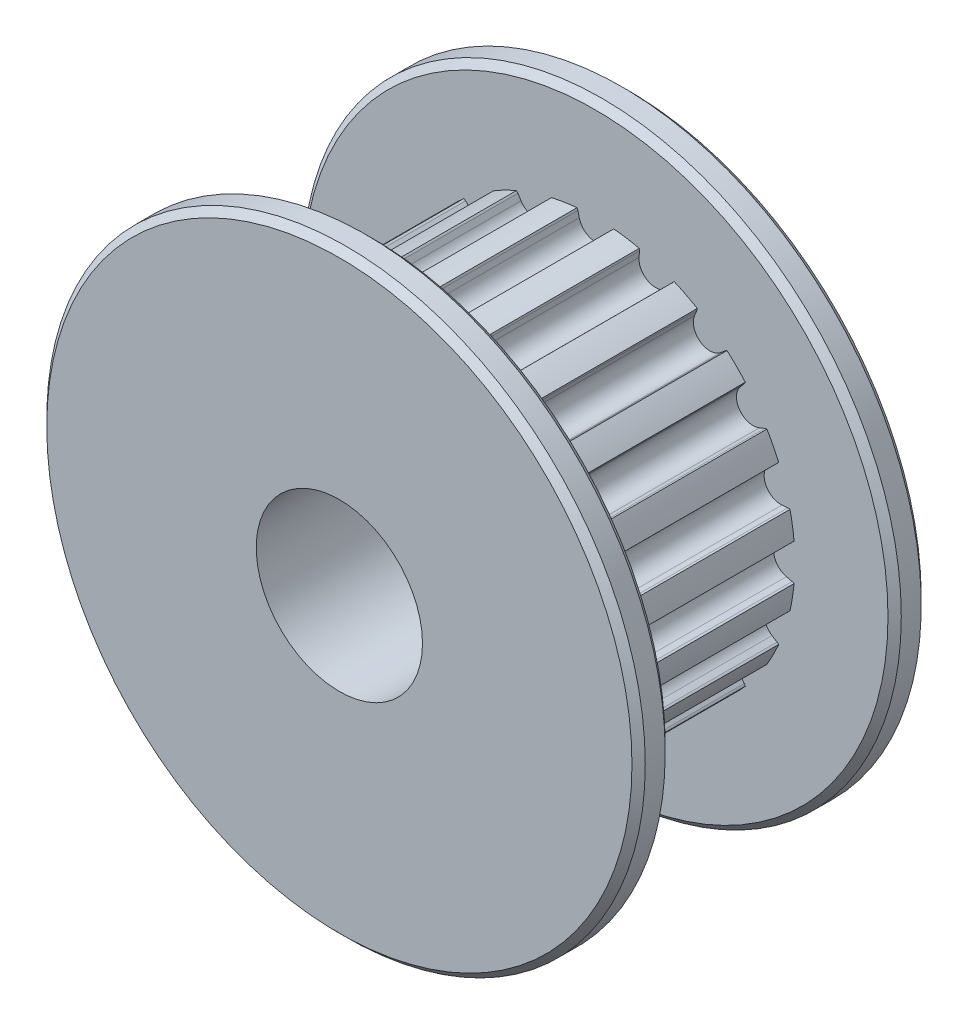
from build123d import *

# Parameters (mm, degrees)
SKETCH_1_W            = 9
SKETCH_1_H            = 1
EXTRUDE_1_DEPTH       = 6.7
EXTRUDE_START         = -1
SKETCH_3_R            = 9
EXTRUDE_2_DEPTH       = 1
HOLE_WIZARD_5_0_5_1_D = 5
CHAMFER_1_SIZE        = 0.2


with BuildPart() as part:
    # Эскиз1 → Повернуть1 (revolve)
    with BuildSketch(Plane.XZ, mode=Mode.PRIVATE) as revolve_1_sk:
        with Locations((4.5, -3.85)):
            Rectangle(SKETCH_1_W, SKETCH_1_H)
    revolve(revolve_1_sk.sketch.rotate(Axis((0, 0, -3.35), (0, 0, -1)), 180), axis=Axis((0, 0, -3.35), (0, 0, -1)))

    # Эскиз2 → Бобышка-Вытянуть1 (add)
    with BuildSketch(Plane.XY.offset(-3.35)):
        with BuildLine():
            Line((5.463115759, 2.329948395), (5.312599321, 2.236873272))
            ThreePointArc((5.312599321, 2.236873272), (5.100040569, 1.657103632), (5.612784256, 1.312999041))
            Line((5.612784256, 1.312999041), (5.789262796, 1.326171027))
            ThreePointArc((5.789262796, 1.326171027), (5.821270379, 1.325991587), (5.852839432, 1.320708365))
            ThreePointArc((5.852839432, 1.320708365), (5.926130044, 0.93860679), (5.97450241, 0.552558553))
            ThreePointArc((5.97450241, 0.552558553), (5.946111062, 0.537778536), (5.915725492, 0.527716992))
            Line((5.915725492, 0.527716992), (5.743814058, 0.485709427))
            ThreePointArc((5.743814058, 0.485709427), (5.3625, 0), (5.743814058, -0.485709427))
            Line((5.743814058, -0.485709427), (5.915725492, -0.527716992))
            ThreePointArc((5.915725492, -0.527716992), (5.946111062, -0.537778536), (5.97450241, -0.552558553))
            ThreePointArc((5.97450241, -0.552558553), (5.926130044, -0.93860679), (5.852839432, -1.320708365))
            ThreePointArc((5.852839432, -1.320708365), (5.821270379, -1.325991587), (5.789262796, -1.326171027))
            Line((5.789262796, -1.326171027), (5.612784256, -1.312999041))
            ThreePointArc((5.612784256, -1.312999041), (5.100040569, -1.657103632), (5.312599321, -2.236873272))
            Line((5.312599321, -2.236873272), (5.463115759, -2.329948395))
            ThreePointArc((5.463115759, -2.329948395), (5.488904965, -2.34890715), (5.511339465, -2.37173719))
            ThreePointArc((5.511339465, -2.37173719), (5.346039145, -2.723942998), (5.158259751, -3.064695147))
            ThreePointArc((5.158259751, -3.064695147), (5.126603192, -3.059964416), (5.096106722, -3.050244186))
            Line((5.096106722, -3.050244186), (4.932336024, -2.983182015))
            ThreePointArc((4.932336024, -2.983182015), (4.338353632, -3.151998415), (4.361350348, -3.769076376))
            Line((4.361350348, -3.769076376), (4.475738192, -3.904108215))
            ThreePointArc((4.475738192, -3.904108215), (4.494406607, -3.930108366), (4.508688214, -3.958753666))
            ThreePointArc((4.508688214, -3.958753666), (4.242640687, -4.242640687), (3.958753666, -4.508688214))
            ThreePointArc((3.958753666, -4.508688214), (3.930108366, -4.494406607), (3.904108215, -4.475738192))
            Line((3.904108215, -4.475738192), (3.769076376, -4.361350348))
            ThreePointArc((3.769076376, -4.361350348), (3.151998415, -4.338353632), (2.983182015, -4.932336024))
            Line((2.983182015, -4.932336024), (3.050244186, -5.096106722))
            ThreePointArc((3.050244186, -5.096106722), (3.059964416, -5.126603192), (3.064695147, -5.158259751))
            ThreePointArc((3.064695147, -5.158259751), (2.723942998, -5.346039145), (2.37173719, -5.511339465))
            ThreePointArc((2.37173719, -5.511339465), (2.34890715, -5.488904965), (2.329948395, -5.463115759))
            Line((2.329948395, -5.463115759), (2.236873272, -5.312599321))
            ThreePointArc((2.236873272, -5.312599321), (1.657103632, -5.100040569), (1.312999041, -5.612784256))
            Line((1.312999041, -5.612784256), (1.326171027, -5.789262796))
            ThreePointArc((1.326171027, -5.789262796), (1.325991587, -5.821270379), (1.320708365, -5.852839432))
            ThreePointArc((1.320708365, -5.852839432), (0.93860679, -5.926130044), (0.552558553, -5.97450241))
            ThreePointArc((0.552558553, -5.97450241), (0.537778536, -5.946111062), (0.527716992, -5.915725492))
            Line((0.527716992, -5.915725492), (0.485709427, -5.743814058))
            ThreePointArc((0.485709427, -5.743814058), (0, -5.3625), (-0.485709427, -5.743814058))
            Line((-0.485709427, -5.743814058), (-0.527716992, -5.915725492))
            ThreePointArc((-0.527716992, -5.915725492), (-0.537778536, -5.946111062), (-0.552558553, -5.97450241))
            ThreePointArc((-0.552558553, -5.97450241), (-0.93860679, -5.926130044), (-1.320708365, -5.852839432))
            ThreePointArc((-1.320708365, -5.852839432), (-1.325991587, -5.821270379), (-1.326171027, -5.789262796))
            Line((-1.326171027, -5.789262796), (-1.312999041, -5.612784256))
            ThreePointArc((-1.312999041, -5.612784256), (-1.657103632, -5.100040569), (-2.236873272, -5.312599321))
            Line((-2.236873272, -5.312599321), (-2.329948395, -5.463115759))
            ThreePointArc((-2.329948395, -5.463115759), (-2.34890715, -5.488904965), (-2.37173719, -5.511339465))
            ThreePointArc((-2.37173719, -5.511339465), (-2.723942998, -5.346039145), (-3.064695147, -5.158259751))
            ThreePointArc((-3.064695147, -5.158259751), (-3.059964416, -5.126603192), (-3.050244186, -5.096106722))
            Line((-3.050244186, -5.096106722), (-2.983182015, -4.932336024))
            ThreePointArc((-2.983182015, -4.932336024), (-3.151998415, -4.338353632), (-3.769076376, -4.361350348))
            Line((-3.769076376, -4.361350348), (-3.904108215, -4.475738192))
            ThreePointArc((-3.904108215, -4.475738192), (-3.930108366, -4.494406607), (-3.958753666, -4.508688214))
            ThreePointArc((-3.958753666, -4.508688214), (-4.242640687, -4.242640687), (-4.508688214, -3.958753666))
            ThreePointArc((-4.508688214, -3.958753666), (-4.494406607, -3.930108366), (-4.475738192, -3.904108215))
            Line((-4.475738192, -3.904108215), (-4.361350348, -3.769076376))
            ThreePointArc((-4.361350348, -3.769076376), (-4.338353632, -3.151998415), (-4.932336024, -2.983182015))
            Line((-4.932336024, -2.983182015), (-5.096106722, -3.050244186))
            ThreePointArc((-5.096106722, -3.050244186), (-5.126603192, -3.059964416), (-5.158259751, -3.064695147))
            ThreePointArc((-5.158259751, -3.064695147), (-5.346039145, -2.723942998), (-5.511339465, -2.37173719))
            ThreePointArc((-5.511339465, -2.37173719), (-5.488904965, -2.34890715), (-5.463115759, -2.329948395))
            Line((-5.463115759, -2.329948395), (-5.312599321, -2.236873272))
            ThreePointArc((-5.312599321, -2.236873272), (-5.100040569, -1.657103632), (-5.612784256, -1.312999041))
            Line((-5.612784256, -1.312999041), (-5.789262796, -1.326171027))
            ThreePointArc((-5.789262796, -1.326171027), (-5.821270379, -1.325991587), (-5.852839432, -1.320708365))
            ThreePointArc((-5.852839432, -1.320708365), (-5.926130044, -0.93860679), (-5.97450241, -0.552558553))
            ThreePointArc((-5.97450241, -0.552558553), (-5.946111062, -0.537778536), (-5.915725492, -0.527716992))
            Line((-5.915725492, -0.527716992), (-5.743814058, -0.485709427))
            ThreePointArc((-5.743814058, -0.485709427), (-5.3625, 0), (-5.743814058, 0.485709427))
            Line((-5.743814058, 0.485709427), (-5.915725492, 0.527716992))
            ThreePointArc((-5.915725492, 0.527716992), (-5.946111062, 0.537778536), (-5.97450241, 0.552558553))
            ThreePointArc((-5.97450241, 0.552558553), (-5.926130044, 0.93860679), (-5.852839432, 1.320708365))
            ThreePointArc((-5.852839432, 1.320708365), (-5.821270379, 1.325991587), (-5.789262796, 1.326171027))
            Line((-5.789262796, 1.326171027), (-5.612784256, 1.312999041))
            ThreePointArc((-5.612784256, 1.312999041), (-5.100040569, 1.657103632), (-5.312599321, 2.236873272))
            Line((-5.312599321, 2.236873272), (-5.463115759, 2.329948395))
            ThreePointArc((-5.463115759, 2.329948395), (-5.488904965, 2.34890715), (-5.511339465, 2.37173719))
            ThreePointArc((-5.511339465, 2.37173719), (-5.346039145, 2.723942998), (-5.158259751, 3.064695147))
            ThreePointArc((-5.158259751, 3.064695147), (-5.126603192, 3.059964416), (-5.096106722, 3.050244186))
            Line((-5.096106722, 3.050244186), (-4.932336024, 2.983182015))
            ThreePointArc((-4.932336024, 2.983182015), (-4.338353632, 3.151998415), (-4.361350348, 3.769076376))
            Line((-4.361350348, 3.769076376), (-4.475738192, 3.904108215))
            ThreePointArc((-4.475738192, 3.904108215), (-4.494406607, 3.930108366), (-4.508688214, 3.958753666))
            ThreePointArc((-4.508688214, 3.958753666), (-4.242640687, 4.242640687), (-3.958753666, 4.508688214))
            ThreePointArc((-3.958753666, 4.508688214), (-3.930108366, 4.494406607), (-3.904108215, 4.475738192))
            Line((-3.904108215, 4.475738192), (-3.769076376, 4.361350348))
            ThreePointArc((-3.769076376, 4.361350348), (-3.151998415, 4.338353632), (-2.983182015, 4.932336024))
            Line((-2.983182015, 4.932336024), (-3.050244186, 5.096106722))
            ThreePointArc((-3.050244186, 5.096106722), (-3.059964416, 5.126603192), (-3.064695147, 5.158259751))
            ThreePointArc((-3.064695147, 5.158259751), (-2.723942998, 5.346039145), (-2.37173719, 5.511339465))
            ThreePointArc((-2.37173719, 5.511339465), (-2.34890715, 5.488904965), (-2.329948395, 5.463115759))
            Line((-2.329948395, 5.463115759), (-2.236873272, 5.312599321))
            ThreePointArc((-2.236873272, 5.312599321), (-1.657103632, 5.100040569), (-1.312999041, 5.612784256))
            Line((-1.312999041, 5.612784256), (-1.326171027, 5.789262796))
            ThreePointArc((-1.326171027, 5.789262796), (-1.325991587, 5.821270379), (-1.320708365, 5.852839432))
            ThreePointArc((-1.320708365, 5.852839432), (-0.93860679, 5.926130044), (-0.552558553, 5.97450241))
            ThreePointArc((-0.552558553, 5.97450241), (-0.537778536, 5.946111062), (-0.527716992, 5.915725492))
            Line((-0.527716992, 5.915725492), (-0.485709427, 5.743814058))
            ThreePointArc((-0.485709427, 5.743814058), (0, 5.3625), (0.485709427, 5.743814058))
            Line((0.485709427, 5.743814058), (0.527716992, 5.915725492))
            ThreePointArc((0.527716992, 5.915725492), (0.537778536, 5.946111062), (0.552558553, 5.97450241))
            ThreePointArc((0.552558553, 5.97450241), (0.93860679, 5.926130044), (1.320708365, 5.852839432))
            ThreePointArc((1.320708365, 5.852839432), (1.325991587, 5.821270379), (1.326171027, 5.789262796))
            Line((1.326171027, 5.789262796), (1.312999041, 5.612784256))
            ThreePointArc((1.312999041, 5.612784256), (1.657103632, 5.100040569), (2.236873272, 5.312599321))
            Line((2.236873272, 5.312599321), (2.329948395, 5.463115759))
            ThreePointArc((2.329948395, 5.463115759), (2.34890715, 5.488904965), (2.37173719, 5.511339465))
            ThreePointArc((2.37173719, 5.511339465), (2.723942998, 5.346039145), (3.064695147, 5.158259751))
            ThreePointArc((3.064695147, 5.158259751), (3.059964416, 5.126603192), (3.050244186, 5.096106722))
            Line((3.050244186, 5.096106722), (2.983182015, 4.932336024))
            ThreePointArc((2.983182015, 4.932336024), (3.151998415, 4.338353632), (3.769076376, 4.361350348))
            Line((3.769076376, 4.361350348), (3.904108215, 4.475738192))
            ThreePointArc((3.904108215, 4.475738192), (3.930108366, 4.494406607), (3.958753666, 4.508688214))
            ThreePointArc((3.958753666, 4.508688214), (4.242640687, 4.242640687), (4.508688214, 3.958753666))
            ThreePointArc((4.508688214, 3.958753666), (4.494406607, 3.930108366), (4.475738192, 3.904108215))
            Line((4.475738192, 3.904108215), (4.361350348, 3.769076376))
            ThreePointArc((4.361350348, 3.769076376), (4.338353632, 3.151998415), (4.932336024, 2.983182015))
            Line((4.932336024, 2.983182015), (5.096106722, 3.050244186))
            ThreePointArc((5.096106722, 3.050244186), (5.126603192, 3.059964416), (5.158259751, 3.064695147))
            ThreePointArc((5.158259751, 3.064695147), (5.346039145, 2.723942998), (5.511339465, 2.37173719))
            ThreePointArc((5.511339465, 2.37173719), (5.488904965, 2.34890715), (5.463115759, 2.329948395))
        make_face()
    extrude(amount=EXTRUDE_1_DEPTH)

    # Эскиз3 → Бобышка-Вытянуть2 (add)
    with BuildSketch(Plane(origin=(0, 0, 3.35), x_dir=(-1, 0, 0), z_dir=(0, 0, -1)).offset(EXTRUDE_START)):
        Circle(SKETCH_3_R)
    extrude(amount=EXTRUDE_2_DEPTH)

    # Диаметр отверстия Ø5.0 (5)1 (through all)
    with Locations(Plane.XY.offset(4.35)):
        with Locations((0, 0)):
            Hole(HOLE_WIZARD_5_0_5_1_D / 2)

    # Фаска1
    chamfer_1_edges = [part.edges().sort_by_distance(p)[0] for p in [
        (9, 0, 4.35),
        (9, 0, 3.35),
        (9, 0, -4.35),
        (9, 0, -3.35),
    ]]
    chamfer(chamfer_1_edges, length=CHAMFER_1_SIZE)


solid = part.part
